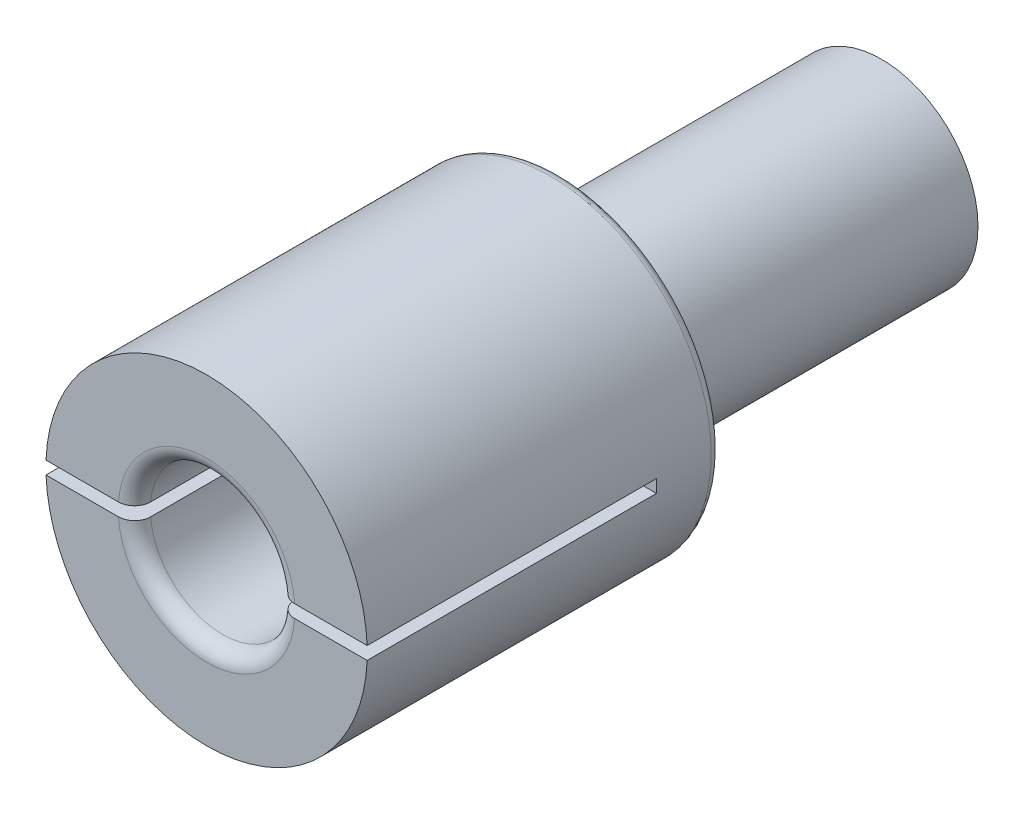
from build123d import *

# Parameters (mm, degrees)
ESBO_O1_R                = 5
RESSALTO_EXTRUS_O1_DEPTH = 11
ESBO_O2_R                = 2.25
CORTE_EXTRUS_O1_DEPTH    = 11
ESBO_O3_R                = 3
RESSALTO_EXTRUS_O2_DEPTH = 10
CORTE_EXTRUS_O2_DEPTH    = 9
FILETE1_R                = 0.5
FILETE2_R                = 0.3


with BuildPart() as part:
    # Esboço1 → Ressalto-extrusão1 (new body)
    with BuildSketch(Plane.XY):
        with Locations((-26.183327478, 4.383756345)):
            Circle(ESBO_O1_R)
    extrude(amount=RESSALTO_EXTRUS_O1_DEPTH)

    # Esboço2 → Corte-extrusão1 (cut)
    with BuildSketch(Plane.XY.offset(11)):
        with Locations((-26.183327478, 4.383756345)):
            Circle(ESBO_O2_R)
    extrude(amount=-CORTE_EXTRUS_O1_DEPTH, mode=Mode.SUBTRACT)

    # Esboço3 → Ressalto-extrusão2 (add)
    with BuildSketch(Plane(origin=(0, 0, 0), x_dir=(-1, 0, 0), z_dir=(0, 0, -1))):
        with Locations(Location((26.183327478, 4.383756345, 0), (0, 0, 180))):
            Circle(ESBO_O3_R)
    extrude(amount=RESSALTO_EXTRUS_O2_DEPTH)

    # Esboço4 → Corte-extrusão2 (cut)
    with BuildSketch(Plane.XY.offset(11)):
        with BuildLine():
            Line((-31.183327478, 4.583756345), (-21.183327478, 4.583756345))
            ThreePointArc((-21.183327478, 4.583756345), (-20.983327478, 4.383756345), (-21.183327478, 4.183756345))
            Line((-21.183327478, 4.183756345), (-31.183327478, 4.183756345))
            ThreePointArc((-31.183327478, 4.183756345), (-31.383327478, 4.383756345), (-31.183327478, 4.583756345))
        make_face()
    extrude(amount=-CORTE_EXTRUS_O2_DEPTH, mode=Mode.SUBTRACT)

    # Filete1
    filete1_edges = [part.edges().sort_by_distance(p)[0] for p in [
        (-26.183327478, 2.133756345, 11),
        (-26.183327478, 6.633756345, 11),
    ]]
    fillet(filete1_edges, radius=FILETE1_R)

    # Filete2
    filete2_edges = [part.edges().sort_by_distance(p)[0] for p in [
        (-31.183327478, 4.383756345, 0),
    ]]
    fillet(filete2_edges, radius=FILETE2_R)


solid = part.part
